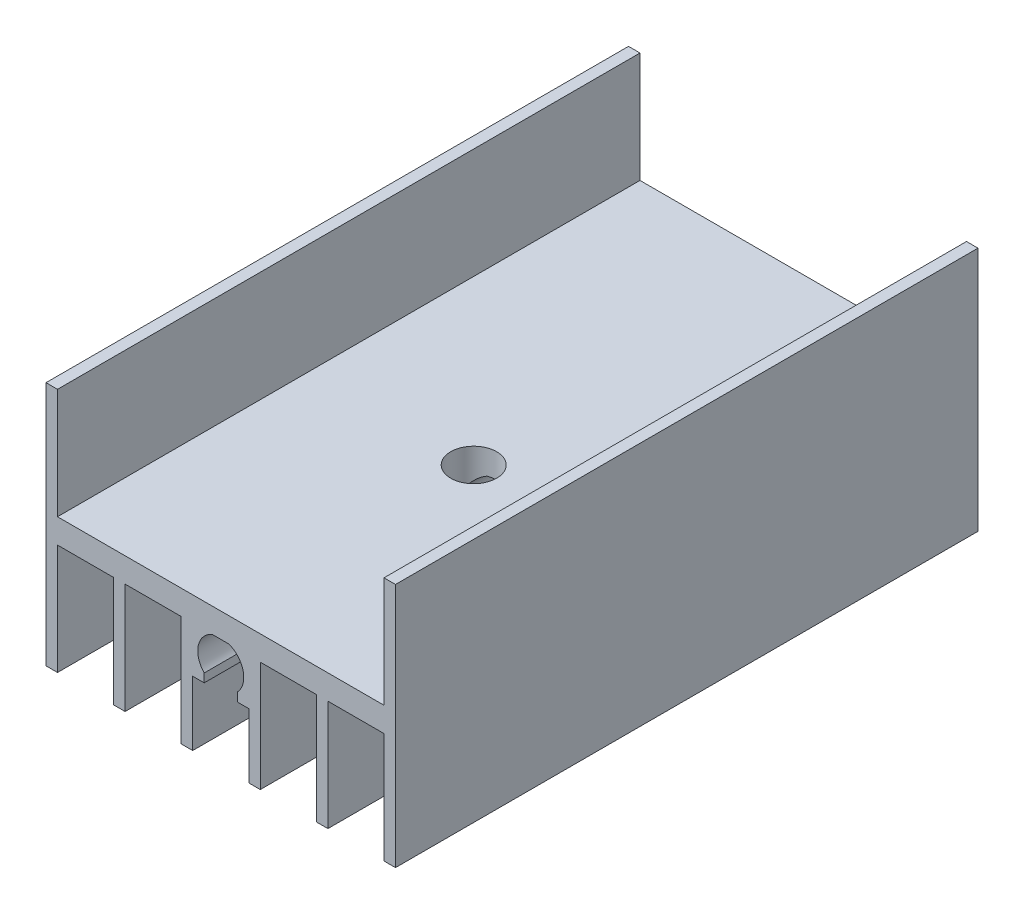
from build123d import *

# Parameters (mm, degrees)
BOSS_EXTRUDE1_DEPTH = 38
SKETCH2_R           = 1.5
CUT_EXTRUDE1_DEPTH  = 11


with BuildPart() as part:
    # Sketch1 → Boss-Extrude1 (new body)
    with BuildSketch(Plane.XY):
        with BuildLine():
            Line((10.65, -8), (11.4, -8))
            Line((11.4, -8), (11.4, 8))
            Line((11.4, 8), (10.65, 8))
            Line((10.65, 8), (10.65, 0.8))
            Line((10.65, 0.8), (-10.65, 0.8))
            Line((-10.65, 0.8), (-10.65, 8))
            Line((-10.65, 8), (-11.4, 8))
            Line((-11.4, 8), (-11.4, -8))
            Line((-11.4, -8), (-10.65, -8))
            Line((-10.65, -8), (-10.65, -0.8))
            Line((-10.65, -0.8), (-6.99, -0.8))
            Line((-6.99, -0.8), (-6.99, -8))
            Line((-6.99, -8), (-6.24, -8))
            Line((-6.24, -8), (-6.24, -0.8))
            Line((-6.24, -0.8), (-2.58, -0.8))
            Line((-2.58, -0.8), (-2.58, -8))
            Line((-2.58, -8), (-1.83, -8))
            Line((-1.83, -8), (-1.83, -3.8))
            Line((-1.83, -3.8), (-1.83, -0.8))
            Line((-1.83, -0.8), (-0.538516481, -0.8))
            ThreePointArc((-0.538516481, -0.8), (0, -0.7), (0.538516481, -0.8))
            Line((0.538516481, -0.8), (1.83, -0.8))
            Line((1.83, -0.8), (1.83, -3.8))
            Line((1.83, -3.8), (1.83, -8))
            Line((1.83, -8), (2.58, -8))
            Line((2.58, -8), (2.58, -0.8))
            Line((2.58, -0.8), (6.24, -0.8))
            Line((6.24, -0.8), (6.24, -8))
            Line((6.24, -8), (6.99, -8))
            Line((6.99, -8), (6.99, -0.8))
            Line((6.99, -0.8), (10.65, -0.8))
            Line((10.65, -0.8), (10.65, -8))
        make_face()
        with BuildLine():
            Line((-1.83, -0.8), (-1.83, -3.8))
            Line((-1.83, -3.8), (-1.08, -3.8))
            Line((-1.08, -3.8), (-1.08, -3.240961094))
            ThreePointArc((-1.08, -3.240961094), (-1.46440147, -1.87514875), (-0.538516481, -0.8))
            Line((-0.538516481, -0.8), (-1.83, -0.8))
        make_face()
        with BuildLine():
            Line((-0.538516481, -0.8), (0.538516481, -0.8))
            ThreePointArc((0.538516481, -0.8), (0, -0.7), (-0.538516481, -0.8))
        make_face()
        with BuildLine():
            Line((1.08, -3.8), (1.83, -3.8))
            Line((1.83, -3.8), (1.83, -0.8))
            Line((1.83, -0.8), (0.538516481, -0.8))
            ThreePointArc((0.538516481, -0.8), (1.46440147, -1.87514875), (1.08, -3.240961094))
            Line((1.08, -3.240961094), (1.08, -3.8))
        make_face()
    extrude(amount=BOSS_EXTRUDE1_DEPTH)

    # Sketch2 → Cut-Extrude1 (cut)
    with BuildSketch(Plane(origin=(0, 0.8, 0), x_dir=(1, 0, 0), z_dir=(0, 1, 0))):
        with Locations(Location((0, -21.5, 0), (0, 0, 180))):
            Circle(SKETCH2_R)
    extrude(amount=-CUT_EXTRUDE1_DEPTH, mode=Mode.SUBTRACT)


solid = part.part
